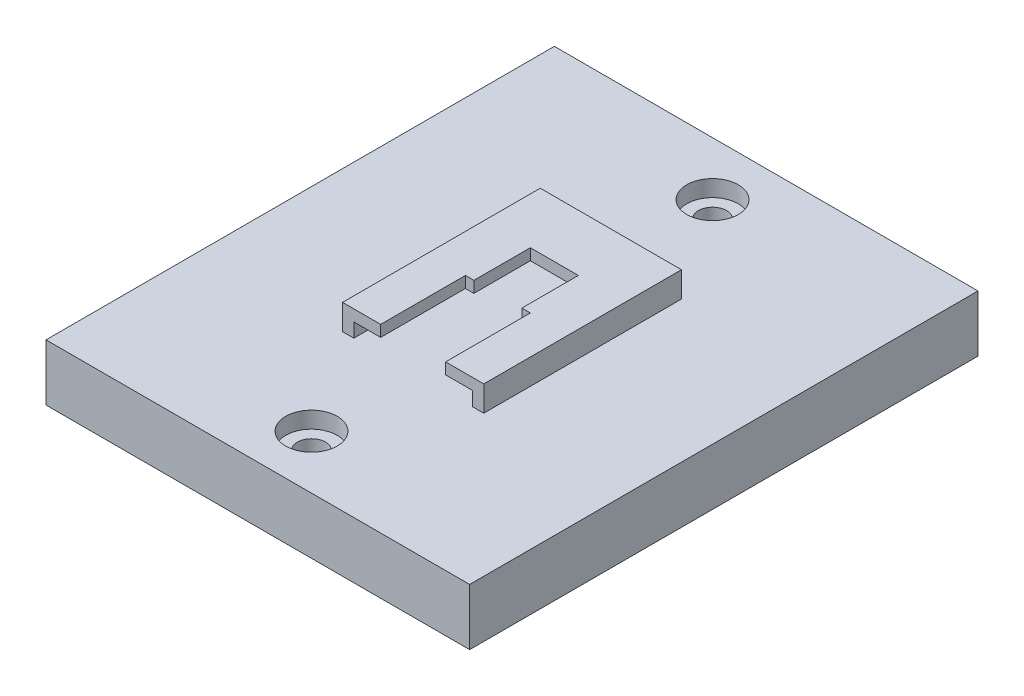
from build123d import *

# Parameters (mm, degrees)
BOSS_EXTRUDE1_DEPTH                             = 2
BOSS_EXTRUDE2_DEPTH                             = 2.5
SKETCH3_W                                       = 75
SKETCH3_H                                       = 90
BOSS_EXTRUDE3_DEPTH                             = 10
CBORE_FOR_8_PAN_HEAD_MACHINE_SCREW1_D           = 4.9784
CBORE_FOR_8_PAN_HEAD_MACHINE_SCREW1_CBORE_D     = 9.12876
CBORE_FOR_8_PAN_HEAD_MACHINE_SCREW1_CBORE_DEPTH = 2.921


with BuildPart() as part:
    # Sketch1 → Boss-Extrude1 (new body)
    with BuildSketch(Plane(origin=(0, 0, 0), x_dir=(1, 0, 0), z_dir=(0, 1, 0))):
        Polygon((12.5, 17.5), (-12.5, 17.5), (-12.5, -17.5), (-5.75, -17.5), (-5.75, -2.5), (-4.25, -2.5), (-4.25, 7.5), (4.25, 7.5), (4.25, -2.5), (5.75, -2.5), (5.75, -17.5), (12.5, -17.5), align=None)
    extrude(amount=BOSS_EXTRUDE1_DEPTH)

    # Sketch2 → Boss-Extrude2 (add)
    with BuildSketch(Plane.XZ):
        Polygon((-12.5, 17.5), (-12.5, -17.5), (12.5, -17.5), (12.5, 17.5), (10.5, 17.5), (10.5, -15.5), (-10.5, -15.5), (-10.5, 17.5), align=None)
    extrude(amount=BOSS_EXTRUDE2_DEPTH)

    # Sketch3 → Boss-Extrude3 (add)
    with BuildSketch(Plane.XZ.offset(2.5)):
        Rectangle(SKETCH3_W, SKETCH3_H)
    extrude(amount=BOSS_EXTRUDE3_DEPTH)

    # CBORE for #8 Pan Head Machine Screw1 (through all)
    with Locations(Plane(origin=(0, -2.5, 0), x_dir=(1, 0, 0), z_dir=(0, 1, 0))):
        with Locations((0, 35.5), (0, -35.5)):
            CounterBoreHole(CBORE_FOR_8_PAN_HEAD_MACHINE_SCREW1_D / 2, CBORE_FOR_8_PAN_HEAD_MACHINE_SCREW1_CBORE_D / 2, CBORE_FOR_8_PAN_HEAD_MACHINE_SCREW1_CBORE_DEPTH)


solid = part.part
